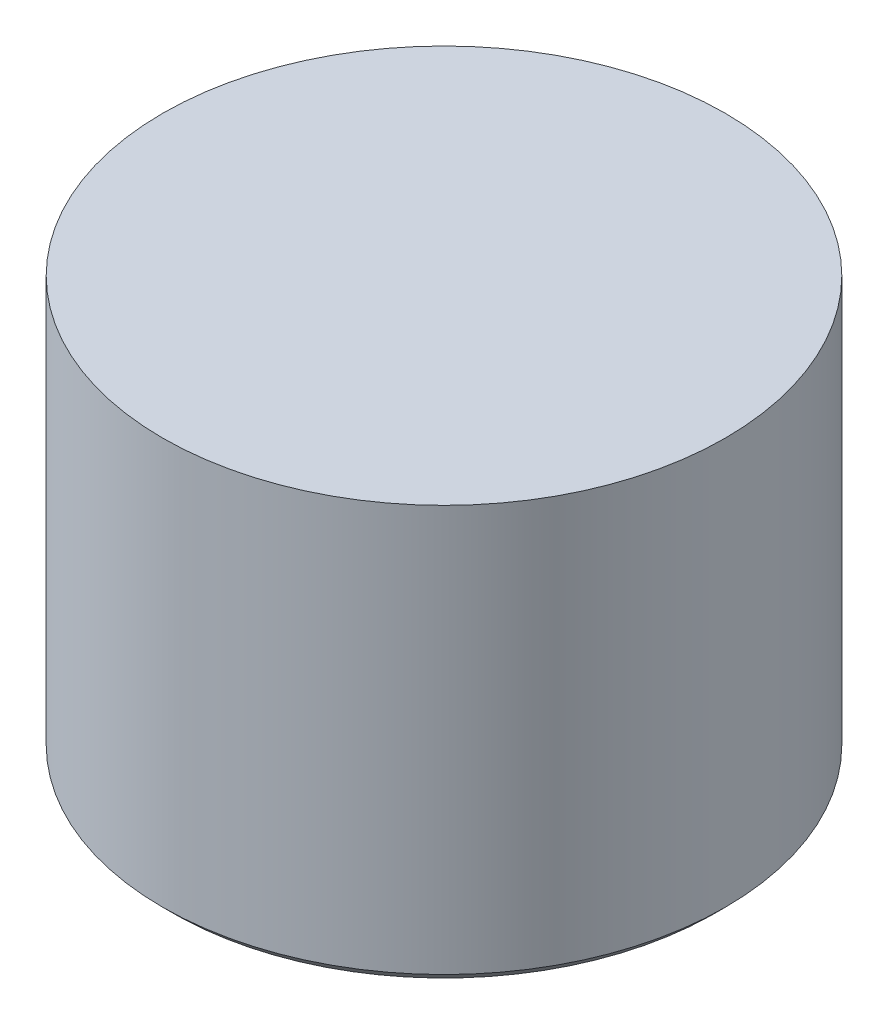
from build123d import *


with BuildPart() as part:
    # Sketch2 → Revolve1 (revolve)
    with BuildSketch(Plane.XY, mode=Mode.PRIVATE) as revolve1_sk:
        Polygon((0, 20), (0, 18), (1.5, 18), (1.5, 13), (3, 13), (3, 15), (6, 18), (9.5, 18), (12.5, 15), (12.5, 0), (13, 0), (13.5, 0.5), (13.5, 20), align=None)
    revolve(revolve1_sk.sketch.rotate(Axis((0, 0, 0), (0, 1, 0)), 90), axis=Axis((0, 0, 0), (0, 1, 0)))


solid = part.part
